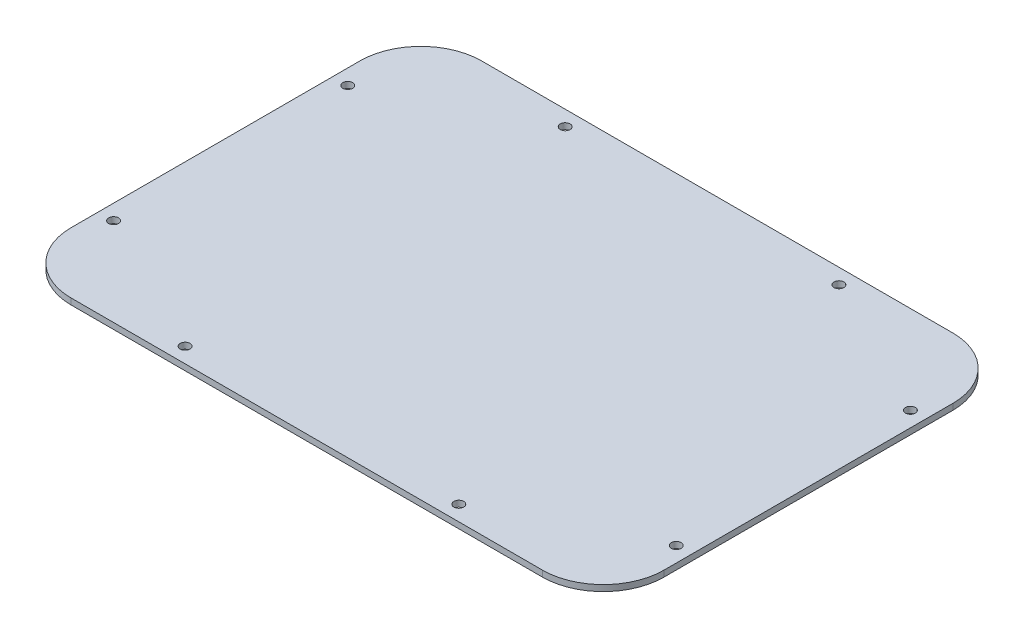
from build123d import *

# Parameters (mm, degrees)
SKETCH_1_W          = 390
SKETCH_1_H          = 270
EXTRUDE_1_DEPTH     = 4
FILLET_1_R          = 40
SKETCH_2_R          = 3.25
CUT_EXTRUDE_1_DEPTH = 238.204553076


with BuildPart() as part:
    # 草图1 → 凸台-拉伸1 (new body)
    with BuildSketch(Plane(origin=(0, 0, 0), x_dir=(1, 0, 0), z_dir=(0, 1, 0))):
        Rectangle(SKETCH_1_W, SKETCH_1_H)
    extrude(amount=EXTRUDE_1_DEPTH)

    # 圆角1
    fillet_1_edges = [part.edges().sort_by_distance(p)[0] for p in [
        (195, 2, 135),
        (-195, 2, 135),
        (-195, 2, -135),
        (195, 2, -135),
    ]]
    fillet(fillet_1_edges, radius=FILLET_1_R)

    # 草图2 → 切除-拉伸1 (cut, through all)
    with BuildSketch(Plane(origin=(0, 4, 0), x_dir=(1, 0, 0), z_dir=(0, 1, 0))):
        with Locations(Location((-185, -77, 0), (0, 0, 270))):
            Circle(SKETCH_2_R)
        with Locations(Location((-185, 77, 0), (0, 0, 270))):
            Circle(SKETCH_2_R)
        with Locations(Location((-90, 125, 0), (0, 0, 270))):
            Circle(SKETCH_2_R)
        with Locations(Location((-90, -125, 0), (0, 0, 270))):
            Circle(SKETCH_2_R)
        with Locations(Location((90, -125, 0), (0, 0, 270))):
            Circle(SKETCH_2_R)
        with Locations(Location((185, -77, 0), (0, 0, 270))):
            Circle(SKETCH_2_R)
        with Locations(Location((185, 77, 0), (0, 0, 270))):
            Circle(SKETCH_2_R)
        with Locations(Location((90, 125, 0), (0, 0, 270))):
            Circle(SKETCH_2_R)
    extrude(amount=-CUT_EXTRUDE_1_DEPTH, mode=Mode.SUBTRACT)


solid = part.part
